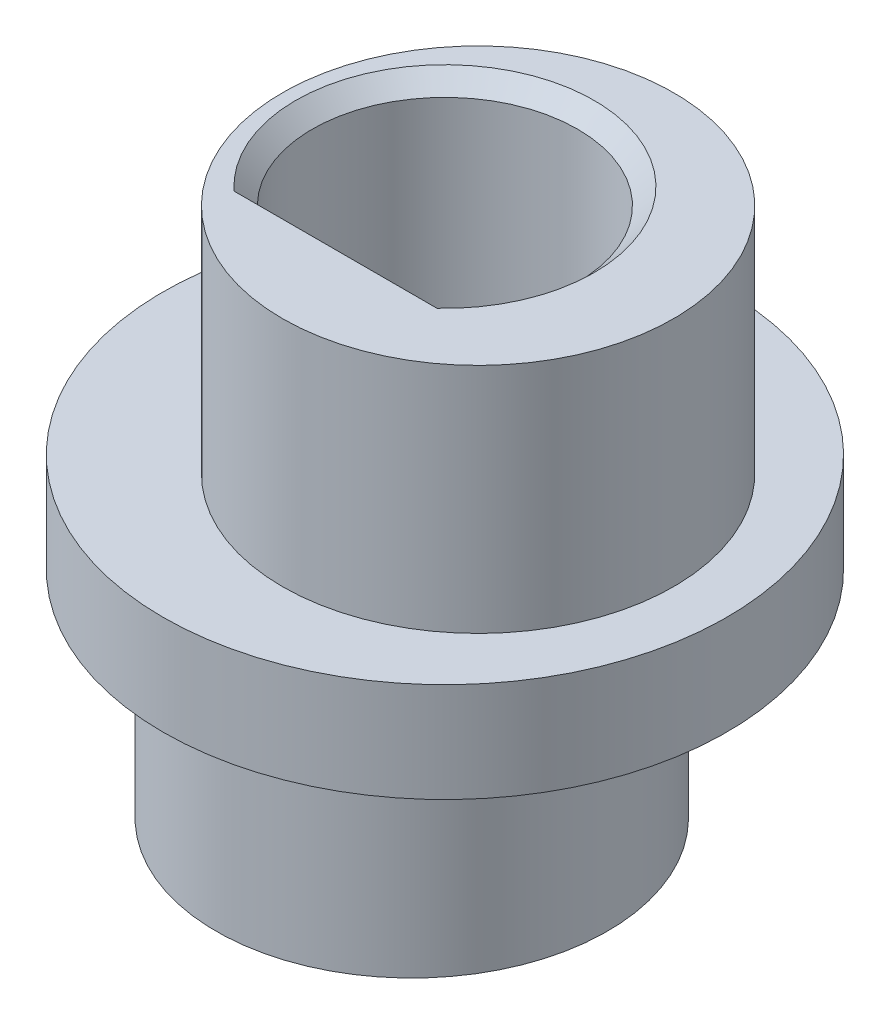
from build123d import *

# Parameters (mm, degrees)
SKIZZE1_R                       = 8.5
AUFSATZ_LINEAR_AUSTRAGEN1_DEPTH = 1.5
SKIZZE2_R                       = 5.9
AUFSATZ_LINEAR_AUSTRAGEN2_DEPTH = 7
SKIZZE3_R                       = 5.9
AUFSATZ_LINEAR_AUSTRAGEN3_DEPTH = 7
SCHNITT_LINEAR_AUSTRAGEN1_DEPTH = 21.820662814
FASE1_SIZE                      = 0.5


with BuildPart() as part:
    # Skizze1 → Aufsatz-Linear austragen1 (new, symmetric)
    with BuildSketch(Plane(origin=(0, 0, 0), x_dir=(1, 0, 0), z_dir=(0, 1, 0))):
        with Locations(Location((0, 0, 0), (0, 0, 270))):
            Circle(SKIZZE1_R)
    extrude(amount=AUFSATZ_LINEAR_AUSTRAGEN1_DEPTH, both=True)

    # Skizze2 → Aufsatz-Linear austragen2 (add)
    with BuildSketch(Plane(origin=(0, 1.5, 0), x_dir=(1, 0, 0), z_dir=(0, 1, 0))):
        with Locations(Location((1, 0, 0), (0, 0, 270))):
            Circle(SKIZZE2_R)
    extrude(amount=AUFSATZ_LINEAR_AUSTRAGEN2_DEPTH)

    # Skizze3 → Aufsatz-Linear austragen3 (add)
    with BuildSketch(Plane.XZ.offset(1.5)):
        with Locations(Location((-1, 0, 0), (0, 0, 270))):
            Circle(SKIZZE3_R)
    extrude(amount=AUFSATZ_LINEAR_AUSTRAGEN3_DEPTH)

    # Skizze4 → Schnitt-Linear austragen1 (cut, through all)
    with BuildSketch(Plane(origin=(0, 8.5, 0), x_dir=(1, 0, 0), z_dir=(0, 1, 0))):
        with BuildLine():
            Line((-2.856571371, -2.8), (2.856571371, -2.8))
            ThreePointArc((2.856571371, -2.8), (0, 4), (-2.856571371, -2.8))
        make_face()
    extrude(amount=-SCHNITT_LINEAR_AUSTRAGEN1_DEPTH, mode=Mode.SUBTRACT)

    # Fase1
    fase1_edges = [part.edges().sort_by_distance(p)[0] for p in [
        (0, -8.5, -4),
        (0, -8.5, 2.8),
        (0, 8.5, -4),
        (0, 8.5, 2.8),
    ]]
    chamfer(fase1_edges, length=FASE1_SIZE)


solid = part.part
